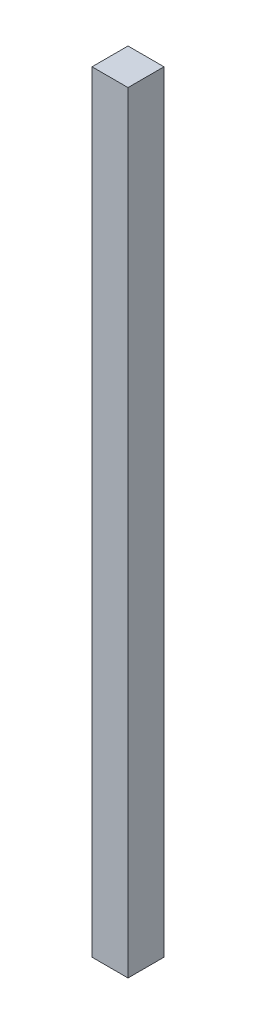
from build123d import *

# Parameters (mm, degrees)
SKETCH2_W           = 70
SKETCH2_H           = 70
BOSS_EXTRUDE1_DEPTH = 1500


with BuildPart() as part:
    # Sketch2 → Boss-Extrude1 (new body)
    with BuildSketch(Plane(origin=(0, 0, 0), x_dir=(1, 0, 0), z_dir=(0, 1, 0))):
        with Locations((10.405405405, -18.783783784)):
            Rectangle(SKETCH2_W, SKETCH2_H)
    extrude(amount=BOSS_EXTRUDE1_DEPTH)


solid = part.part
